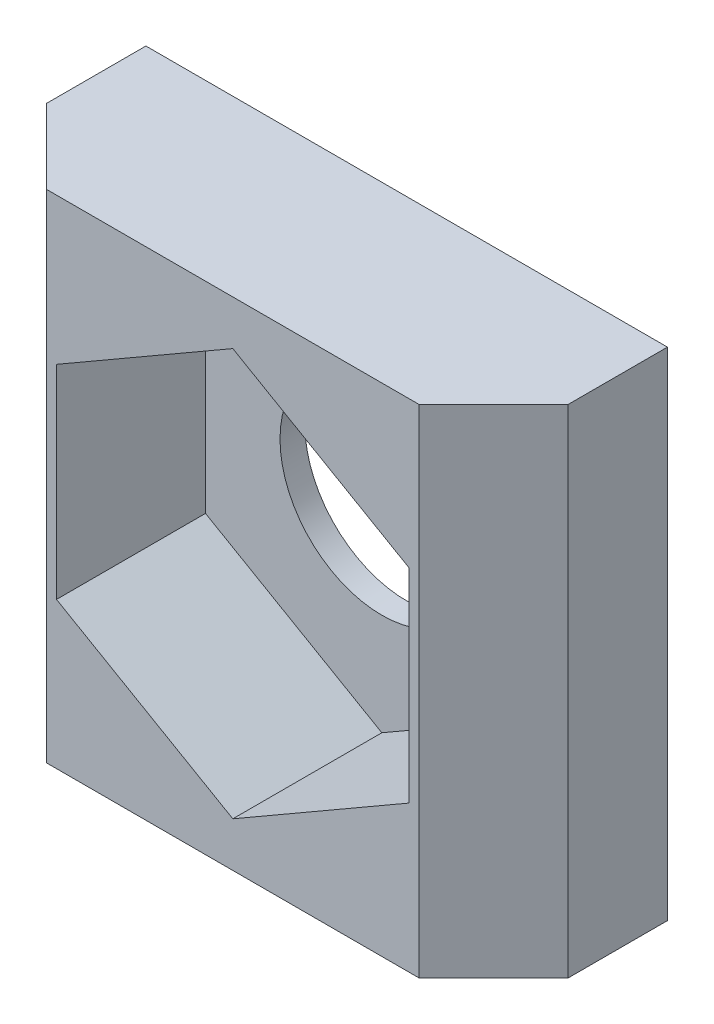
from build123d import *

# Parameters (mm, degrees)
BOSS_EXTRU_1_DEPTH      = 10
ENL_V_MAT_EXTRU_2_DEPTH = 3
ESQUISSE5_R             = 2.05
ENL_V_MAT_EXTRU_3_DEPTH = 12.82423359


with BuildPart() as part:
    # Esquisse1 → Boss.-Extru.1 (new body)
    with BuildSketch(Plane(origin=(0, 0, 0), x_dir=(1, 0, 0), z_dir=(0, 1, 0))):
        Polygon((3.75, 0), (-3.75, 0), (-5.25, 1.5), (-5.25, 3.5), (5.25, 3.5), (5.25, 1.5), align=None)
    extrude(amount=BOSS_EXTRU_1_DEPTH)

    # Esquisse4 → Enlèv. mat.-Extru.2 (cut)
    with BuildSketch(Plane.XY):
        Polygon((3.55, 7.049593456), (0, 9.099186911), (-3.55, 7.049593456), (-3.55, 2.950406544), (0, 0.900813089), (3.55, 2.950406544), align=None)
    extrude(amount=-ENL_V_MAT_EXTRU_2_DEPTH, mode=Mode.SUBTRACT)

    # Esquisse5 → Enlèv. mat.-Extru.3 (cut, through all)
    with BuildSketch(Plane(origin=(0, 0, -3.5), x_dir=(-1, 0, 0), z_dir=(0, 0, -1))):
        with Locations((0, 5)):
            Circle(ESQUISSE5_R)
    extrude(amount=-ENL_V_MAT_EXTRU_3_DEPTH, mode=Mode.SUBTRACT)


solid = part.part
